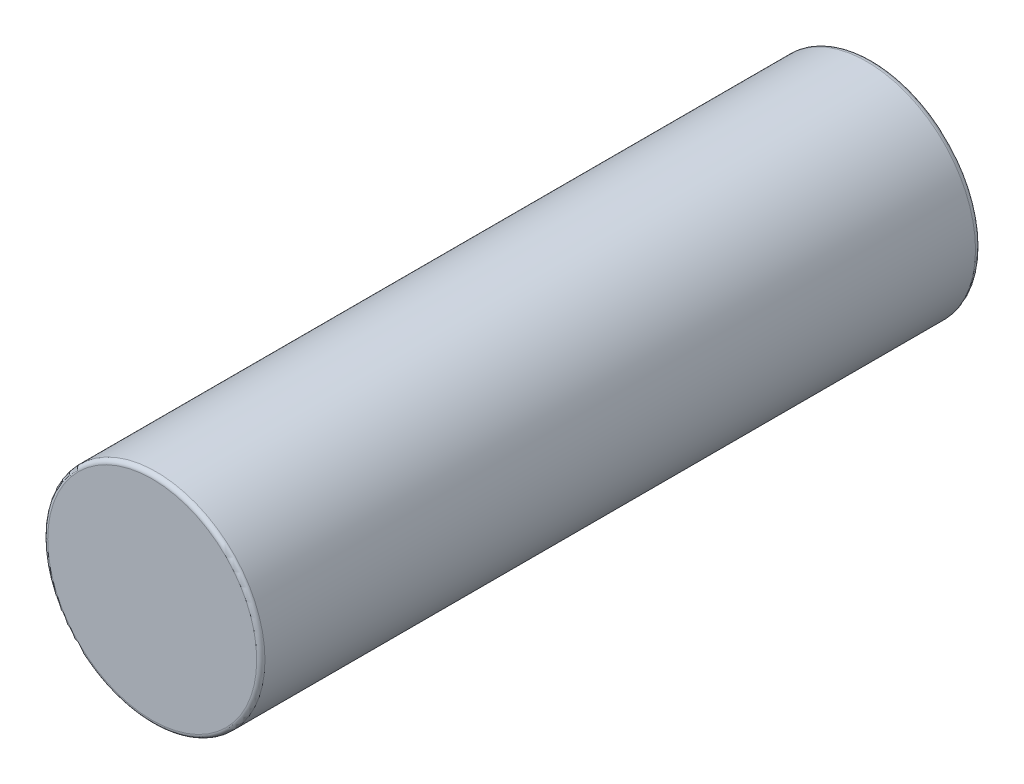
from build123d import *

# Parameters (mm, degrees)
CUT_EXTRUDE1_REACH = 73.652


with BuildPart() as part:
    # Sketch1 → Revolve1 (revolve)
    with BuildSketch(Plane(origin=(0, 0, 0), x_dir=(1, 0, 0), z_dir=(0, 1, 0))):
        with BuildLine():
            Line((0, 70.09), (4.39217757, 70.09))
            ThreePointArc((4.39217757, 70.09), (4.487086316, 70.066046386), (4.559260987, 69.9999233))
            Line((4.559260987, 69.9999233), (5.440739013, 68.6600767))
            ThreePointArc((5.440739013, 68.6600767), (5.512913684, 68.593953614), (5.60782243, 68.57))
            Line((5.60782243, 68.57), (6.955, 68.57))
            Line((6.955, 68.57), (6.955, 68.67))
            Line((6.955, 68.67), (7.745, 68.67))
            Line((7.745, 68.67), (7.745, 68.97))
            Line((7.745, 68.97), (8.1, 68.97))
            Line((8.1, 68.97), (8.1, 69.15596492))
            ThreePointArc((8.1, 69.15596492), (8.127103293, 69.256497147), (8.201067285, 69.32978183))
            ThreePointArc((8.201067285, 69.32978183), (9.040599123, 69.672998391), (9.94, 69.79))
            ThreePointArc((9.94, 69.79), (10.350121933, 69.620121933), (10.52, 69.21))
            Line((10.52, 69.21), (10.52, 0.4))
            ThreePointArc((10.52, 0.4), (10.402842712, 0.117157288), (10.12, 0))
            Line((10.12, 0), (0, 0))
            Line((0, 0), (0, 68.27))
            Line((0, 68.27), (5.338266355, 68.27))
            Line((5.338266355, 68.27), (4.338266355, 69.79))
            Line((4.338266355, 69.79), (0, 69.79))
            Line((0, 69.79), (0, 70.09))
        make_face()
    revolve(axis=Axis((0, 0, 0), (0, 0, -1)))

    # Cut-Extrude1: up to this face of the body (flat: up to its plane)
    cut_extrude1_end = Plane(part.part.faces().sort_by_distance((0, 0, -68.27))[0])
    # Sketch2 → Cut-Extrude1 (cut, up to the picked face)
    with BuildSketch(Plane(origin=(0, 0, -70.09), x_dir=(-1, 0, 0), z_dir=(0, 0, -1)), mode=Mode.PRIVATE) as cut_extrude1_sk1:
        with BuildLine():
            ThreePointArc((5.588090856, -0.470013816), (4.856516684, 2.803911215), (2.387001523, 5.074435548))
            ThreePointArc((2.387001523, 5.074435548), (1.65, 4.808984945), (1.915450603, 4.071983422))
            ThreePointArc((1.915450603, 4.071983422), (3.897114317, 2.25), (4.484166389, -0.377162829))
            ThreePointArc((4.484166389, -0.377162829), (4.989703129, -0.975550556), (5.588090856, -0.470013816))
        make_face()
    cut_extrude1_tool1 = split(extrude(cut_extrude1_sk1.sketch, amount=-CUT_EXTRUDE1_REACH, mode=Mode.PRIVATE), bisect_by=cut_extrude1_end, keep=Keep.BOTH, mode=Mode.PRIVATE)
    # Sketch2 → Cut-Extrude1 (cut, up to the picked face)
    with BuildSketch(Plane(origin=(0, 0, -70.09), x_dir=(-1, 0, 0), z_dir=(0, 0, -1)), mode=Mode.PRIVATE) as cut_extrude1_sk2:
        with BuildLine():
            ThreePointArc((-3.201089333, -4.604421732), (0, -5.60782243), (3.201089333, -4.604421732))
            ThreePointArc((3.201089333, -4.604421732), (3.339703129, -3.833434389), (2.568715786, -3.694820593))
            ThreePointArc((2.568715786, -3.694820593), (0, -4.5), (-2.568715786, -3.694820593))
            ThreePointArc((-2.568715786, -3.694820593), (-3.339703129, -3.833434389), (-3.201089333, -4.604421732))
        make_face()
    cut_extrude1_tool2 = split(extrude(cut_extrude1_sk2.sketch, amount=-CUT_EXTRUDE1_REACH, mode=Mode.PRIVATE), bisect_by=cut_extrude1_end, keep=Keep.BOTH, mode=Mode.PRIVATE)
    # Sketch2 → Cut-Extrude1 (cut, up to the picked face)
    with BuildSketch(Plane(origin=(0, 0, -70.09), x_dir=(-1, 0, 0), z_dir=(0, 0, -1)), mode=Mode.PRIVATE) as cut_extrude1_sk3:
        with BuildLine():
            ThreePointArc((-2.387001523, 5.074435548), (-4.856516684, 2.803911215), (-5.588090856, -0.470013816))
            ThreePointArc((-5.588090856, -0.470013816), (-4.989703129, -0.975550556), (-4.484166389, -0.377162829))
            ThreePointArc((-4.484166389, -0.377162829), (-3.897114317, 2.25), (-1.915450603, 4.071983422))
            ThreePointArc((-1.915450603, 4.071983422), (-1.65, 4.808984945), (-2.387001523, 5.074435548))
        make_face()
    cut_extrude1_tool3 = split(extrude(cut_extrude1_sk3.sketch, amount=-CUT_EXTRUDE1_REACH, mode=Mode.PRIVATE), bisect_by=cut_extrude1_end, keep=Keep.BOTH, mode=Mode.PRIVATE)
    add(cut_extrude1_tool1.solids().sort_by(Axis((-4.048123, 2.337185, -70.09), (0, 0, 1)))[0], mode=Mode.SUBTRACT)
    add(cut_extrude1_tool2.solids().sort_by(Axis((0, -4.67437, -70.09), (0, 0, 1)))[0], mode=Mode.SUBTRACT)
    add(cut_extrude1_tool3.solids().sort_by(Axis((4.048123, 2.337185, -70.09), (0, 0, 1)))[0], mode=Mode.SUBTRACT)


solid = part.part
